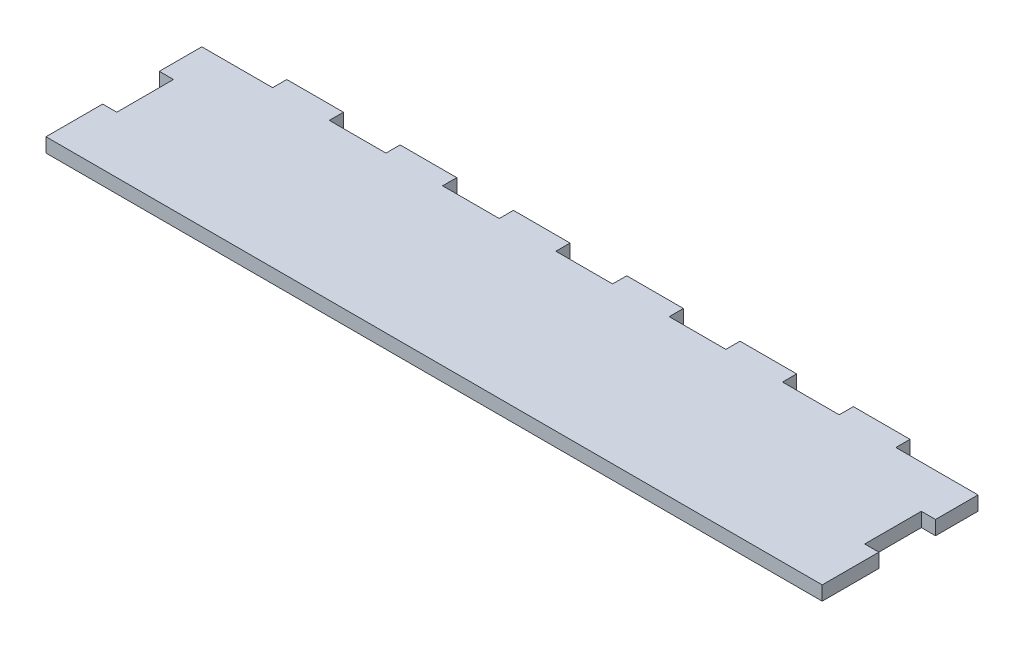
from build123d import *

# Parameters (mm, degrees)
SKETCH1_W           = 173.99
SKETCH1_H           = 38.1
BOSS_EXTRUDE1_DEPTH = 3.175
SKETCH2_W           = 15.875
SKETCH2_H           = 3.175
SKETCH2_W_2         = 12.7
SKETCH2_W_3         = 3.175
SKETCH2_H_2         = 12.7
CUT_EXTRUDE1_DEPTH  = 3.175


with BuildPart() as part:
    # Sketch1 → Boss-Extrude1 (new body)
    with BuildSketch(Plane(origin=(0, 0, 0), x_dir=(1, 0, 0), z_dir=(0, 1, 0))):
        Rectangle(SKETCH1_W, SKETCH1_H)
    extrude(amount=BOSS_EXTRUDE1_DEPTH)

    # Sketch2 → Cut-Extrude1 (cut)
    with BuildSketch(Plane(origin=(0, 3.175, 0), x_dir=(1, 0, 0), z_dir=(0, 1, 0))):
        with Locations((-79.0575, 17.4625)):
            Rectangle(SKETCH2_W, SKETCH2_H)
        with Locations((-52.07, 17.4625)):
            Rectangle(SKETCH2_W_2, SKETCH2_H)
        with Locations((-26.67, 17.4625)):
            Rectangle(SKETCH2_W_2, SKETCH2_H)
        with Locations((-1.27, 17.4625)):
            Rectangle(SKETCH2_W_2, SKETCH2_H)
        with Locations((24.13, 17.4625)):
            Rectangle(SKETCH2_W_2, SKETCH2_H)
        with Locations((49.53, 17.4625)):
            Rectangle(SKETCH2_W_2, SKETCH2_H)
        Polygon((68.58, 19.05), (68.58, 15.875), (81.28, 15.875), (86.995, 15.875), (86.995, 19.05), (81.28, 19.05), align=None)
        with Locations((-85.4075, 0)):
            Rectangle(SKETCH2_W_3, SKETCH2_H_2)
        with Locations((85.4075, 0)):
            Rectangle(SKETCH2_W_3, SKETCH2_H_2)
    extrude(amount=-CUT_EXTRUDE1_DEPTH, mode=Mode.SUBTRACT)


solid = part.part
